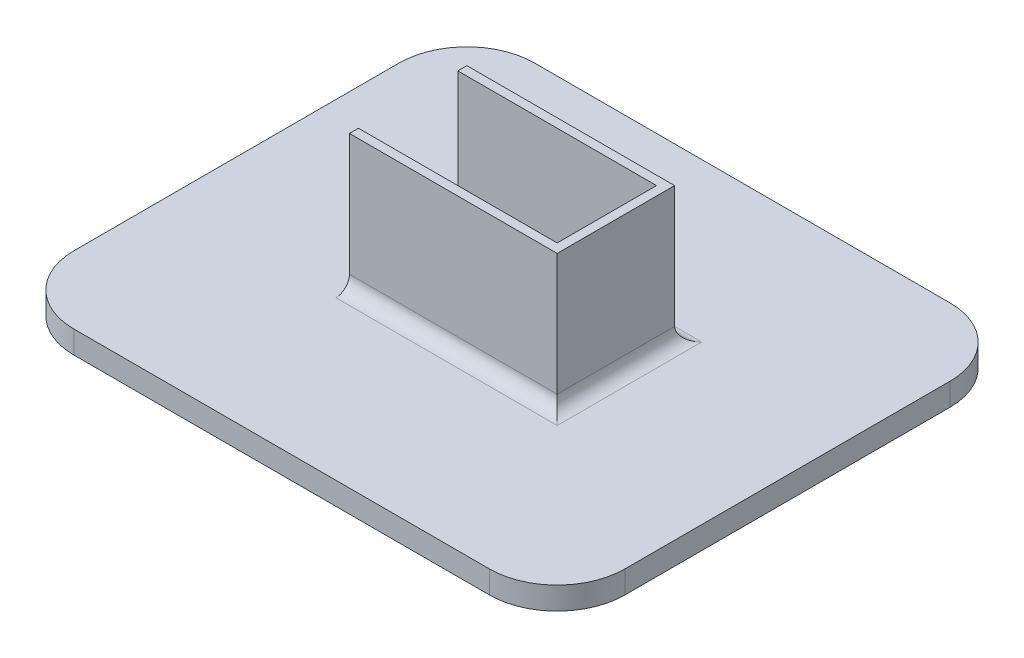
from build123d import *

# Parameters (mm, degrees)
SKETCH1_W           = 122
SKETCH1_H           = 102
BOSS_EXTRUDE1_DEPTH = 5
SKETCH2_W           = 46
SKETCH2_H           = 26
SKETCH2_W_2         = 42
SKETCH2_H_2         = 22
BOSS_EXTRUDE2_DEPTH = 30
SKETCH3_W           = 22
SKETCH3_H           = 30
CUT_EXTRUDE1_DEPTH  = 2
FILLET1_R           = 3
FILLET2_R           = 15


with BuildPart() as part:
    # Sketch1 → Boss-Extrude1 (new body)
    with BuildSketch(Plane(origin=(0, 0, 0), x_dir=(1, 0, 0), z_dir=(0, 1, 0))):
        Rectangle(SKETCH1_W, SKETCH1_H)
    extrude(amount=BOSS_EXTRUDE1_DEPTH)

    # Sketch2 → Boss-Extrude2 (add)
    with BuildSketch(Plane(origin=(0, 5, 0), x_dir=(1, 0, 0), z_dir=(0, 1, 0))):
        Rectangle(SKETCH2_W, SKETCH2_H)
        Rectangle(SKETCH2_W_2, SKETCH2_H_2, mode=Mode.SUBTRACT)
    extrude(amount=BOSS_EXTRUDE2_DEPTH)

    # Sketch3 → Cut-Extrude1 (cut)
    with BuildSketch(Plane.ZY.offset(23)):
        with Locations((0, 20)):
            Rectangle(SKETCH3_W, SKETCH3_H)
    extrude(amount=-CUT_EXTRUDE1_DEPTH, mode=Mode.SUBTRACT)

    # Fillet1
    fillet1_edges = [part.edges().sort_by_distance(p)[0] for p in [
        (0, 5, 13),
        (23, 5, 0),
        (0, 5, -13),
    ]]
    fillet(fillet1_edges, radius=FILLET1_R)

    # Fillet2
    fillet2_edges = [part.edges().sort_by_distance(p)[0] for p in [
        (-61, 2.5, -51),
        (61, 2.5, -51),
        (61, 2.5, 51),
        (-61, 2.5, 51),
    ]]
    fillet(fillet2_edges, radius=FILLET2_R)


solid = part.part
